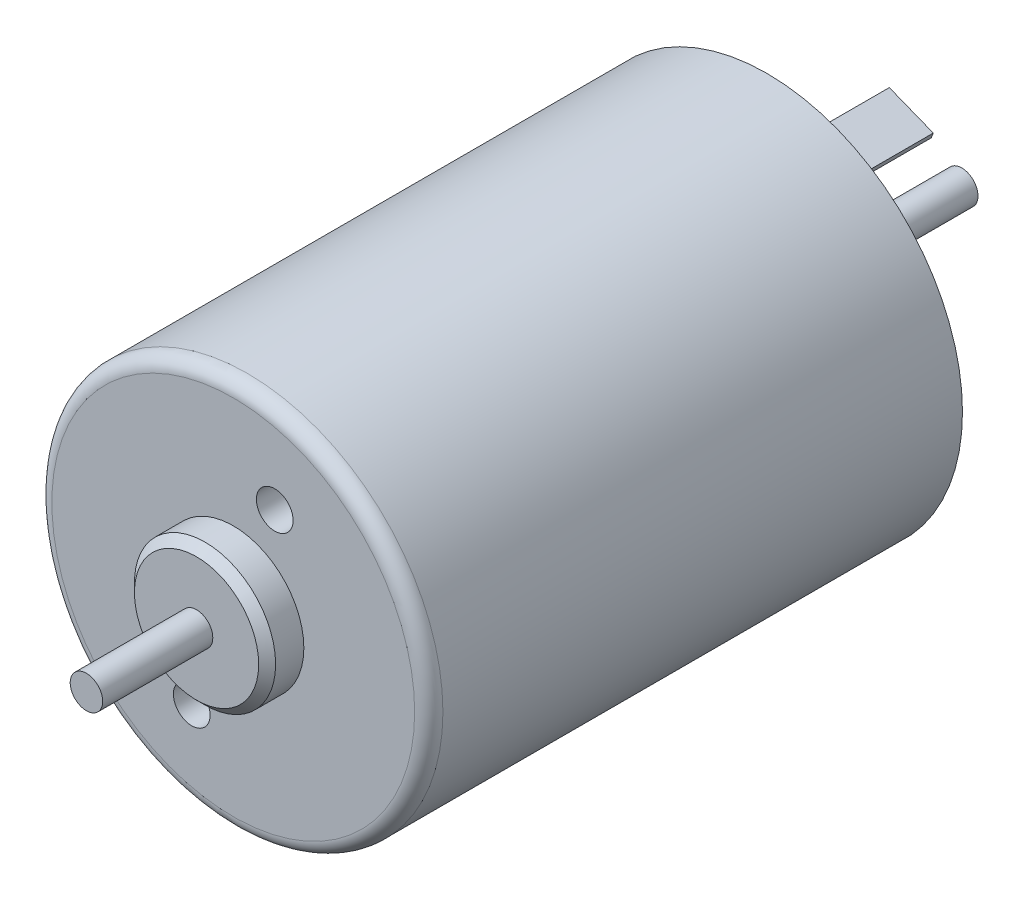
from build123d import *

# Parameters (mm, degrees)
SKETCH1_W                      = 13.85
SKETCH1_H                      = 20
SKETCH2_R                      = 13.85
BOSS_EXTRUDE1_DEPTH            = 12.9
BOSS_EXTRUDE2_DEPTH            = 6
BOSS_EXTRUDE3_DEPTH            = 6
BOSS_EXTRUDE4_START            = 4.9
SKETCH5_R                      = 13.85
BOSS_EXTRUDE4_DEPTH            = 4.9
SKETCH6_R                      = 5
BOSS_EXTRUDE5_DEPTH            = 2.6
SKETCH7_R                      = 1.15
BOSS_EXTRUDE6_DEPTH            = 7.8
BOSS_EXTRUDE7_START            = 2.6
SKETCH8_R                      = 5
BOSS_EXTRUDE7_DEPTH            = 2.6
BOSS_EXTRUDE8_START            = 11.2
SKETCH9_R                      = 1.15
BOSS_EXTRUDE8_DEPTH            = 11.2
F_2_6_2_6_DIAMETER_HOLE1_D     = 2.6
F_2_6_2_6_DIAMETER_HOLE1_DEPTH = 3.216319987
CHAMFER1_SIZE                  = 0.6
FILLET1_R                      = 1


with BuildPart() as part:
    # Sketch1 → Revolve1 (revolve)
    with BuildSketch(Plane.XZ, mode=Mode.PRIVATE) as revolve1_sk:
        with Locations((6.925, 22.9)):
            Rectangle(SKETCH1_W, SKETCH1_H)
    revolve(revolve1_sk.sketch.rotate(Axis((0, 0, 32.9), (0, 0, -1)), 270), axis=Axis((0, 0, 32.9), (0, 0, -1)))

    # Sketch2 → Boss-Extrude1 (add)
    with BuildSketch(Plane(origin=(0, 0, 12.9), x_dir=(-1, 0, 0), z_dir=(0, 0, -1))):
        with Locations(Location((0, 0, 0), (0, 0, 90))):
            Circle(SKETCH2_R)
    extrude(amount=BOSS_EXTRUDE1_DEPTH)

    # Sketch3 → Boss-Extrude2 (add)
    with BuildSketch(Plane(origin=(0, 0, 0), x_dir=(-1, 0, 0), z_dir=(0, 0, -1))):
        Polygon((-5.782608477, 10.080528964), (-2.666854949, 11.311211681), (-2.519907759, 10.939181409), (-5.635661287, 9.708498692), align=None)
    extrude(amount=BOSS_EXTRUDE2_DEPTH)

    # Sketch4 → Boss-Extrude3 (add)
    with BuildSketch(Plane(origin=(0, 0, 0), x_dir=(-1, 0, 0), z_dir=(0, 0, -1))):
        Polygon((2.519907759, -10.939181409), (5.635661287, -9.708498692), (5.782608477, -10.080528964), (2.666854949, -11.311211681), align=None)
    extrude(amount=BOSS_EXTRUDE3_DEPTH)

    # Sketch5 → Boss-Extrude4 (add)
    with BuildSketch(Plane.XY.offset(32.9).offset(BOSS_EXTRUDE4_START)):
        with Locations(Location((0, 0, 0), (0, 0, 90))):
            Circle(SKETCH5_R)
    extrude(amount=-BOSS_EXTRUDE4_DEPTH)

    # Sketch6 → Boss-Extrude5 (add)
    with BuildSketch(Plane.XY.offset(37.8)):
        Circle(SKETCH6_R)
    extrude(amount=BOSS_EXTRUDE5_DEPTH)

    # Sketch7 → Boss-Extrude6 (add)
    with BuildSketch(Plane.XY.offset(40.4)):
        Circle(SKETCH7_R)
    extrude(amount=BOSS_EXTRUDE6_DEPTH)

    # Sketch8 → Boss-Extrude7 (add)
    with BuildSketch(Plane(origin=(0, 0, 0), x_dir=(-1, 0, 0), z_dir=(0, 0, -1)).offset(BOSS_EXTRUDE7_START)):
        with Locations(Location((0, 0, 0), (0, 0, 180))):
            Circle(SKETCH8_R)
    extrude(amount=-BOSS_EXTRUDE7_DEPTH)

    # Sketch9 → Boss-Extrude8 (add)
    with BuildSketch(Plane(origin=(0, 0, -2.6), x_dir=(-1, 0, 0), z_dir=(0, 0, -1)).offset(BOSS_EXTRUDE8_START)):
        with Locations(Location((0, 0, 0), (0, 0, 180))):
            Circle(SKETCH9_R)
    extrude(amount=-BOSS_EXTRUDE8_DEPTH)

    # Ø2.6 (2.6) Diameter Hole1
    with Locations(Plane.XY.offset(37.8)):
        with Locations((-2.9389438, -7.440605442), (2.9389438, 7.440605442)):
            Hole(F_2_6_2_6_DIAMETER_HOLE1_D / 2, depth=F_2_6_2_6_DIAMETER_HOLE1_DEPTH)

    # Chamfer1
    chamfer1_edges = [part.edges().sort_by_distance(p)[0] for p in [
        (-5, 0, 40.4),
        (-5, 0, -2.6),
    ]]
    chamfer(chamfer1_edges, length=CHAMFER1_SIZE)

    # Fillet1
    fillet1_edges = [part.edges().sort_by_distance(p)[0] for p in [
        (0, -13.85, 37.8),
    ]]
    fillet(fillet1_edges, radius=FILLET1_R)


solid = part.part
